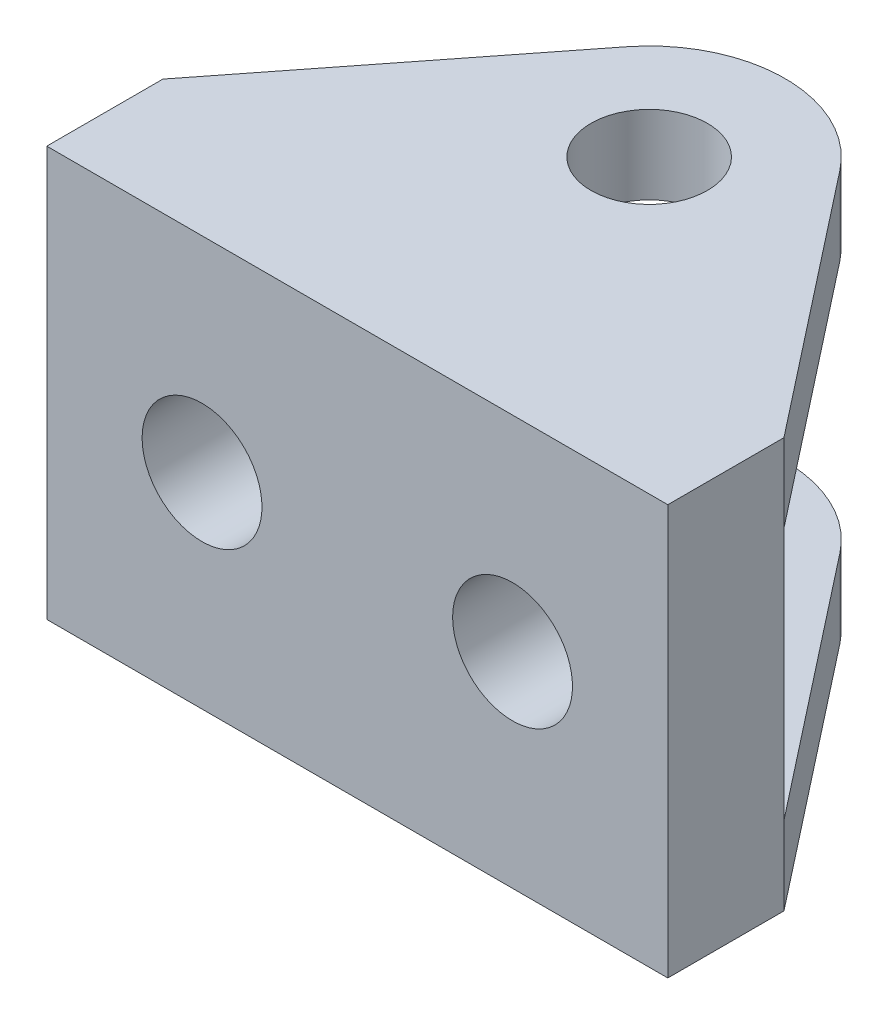
from build123d import *

# Parameters (mm, degrees)
SKETCH1_R           = 4.7625
BOSS_EXTRUDE1_DEPTH = 33.528
CUT_EXTRUDE1_DEPTH  = 71.206566048
SKETCH3_R           = 4.9022
CUT_EXTRUDE2_DEPTH  = 9.4996


with BuildPart() as part:
    # Sketch1 → Boss-Extrude1 (new body)
    with BuildSketch(Plane(origin=(0, 0, 0), x_dir=(1, 0, 0), z_dir=(0, 1, 0))):
        with BuildLine():
            Line((0, 0), (50.8, 0))
            Line((50.8, 0), (50.8, 9.4996))
            Line((50.8, 9.4996), (34.143571574, 30.734397216))
            ThreePointArc((34.143571574, 30.734397216), (25.4, 34.9885), (16.656428426, 30.734397216))
            Line((16.656428426, 30.734397216), (0, 9.4996))
            Line((0, 9.4996), (0, 0))
        make_face()
        with Locations(Location((25.4, 23.876, 0), (0, 0, 270))):
            Circle(SKETCH1_R, mode=Mode.SUBTRACT)
    extrude(amount=BOSS_EXTRUDE1_DEPTH)

    # Sketch2 → Cut-Extrude1 (cut, through all)
    with BuildSketch(Plane(origin=(50.8, 0, 0), x_dir=(0, 0, -1), z_dir=(1, 0, 0))):
        Polygon((9.4996, 16.764), (9.4996, 27.1145), (34.9885, 27.1145), (34.9885, 6.4135), (9.4996, 6.4135), align=None)
    extrude(amount=-CUT_EXTRUDE1_DEPTH, mode=Mode.SUBTRACT)

    # Sketch3 → Cut-Extrude2 (cut)
    with BuildSketch(Plane(origin=(0, 0, -9.4996), x_dir=(-1, 0, 0), z_dir=(0, 0, -1))):
        with Locations((-38.1, 16.764)):
            Circle(SKETCH3_R)
        with Locations((-12.7, 16.764)):
            Circle(SKETCH3_R)
    extrude(amount=-CUT_EXTRUDE2_DEPTH, mode=Mode.SUBTRACT)


solid = part.part
